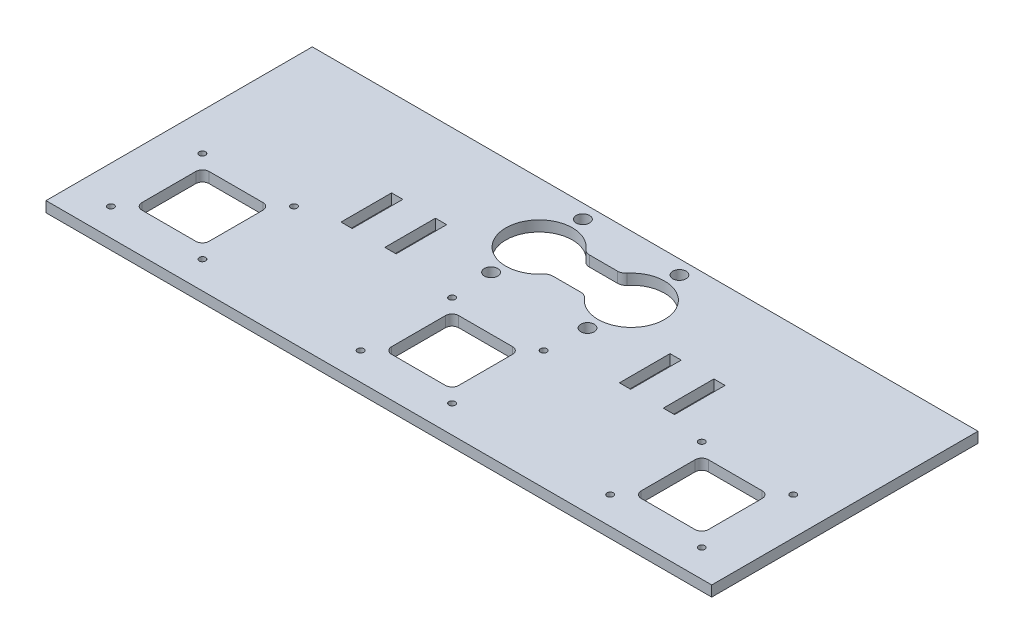
from build123d import *

# Parameters (mm, degrees)
SKETCH1_W           = 200
SKETCH1_H           = 80
BOSS_EXTRUDE1_DEPTH = 3.175
SKETCH3_W           = 20.17
SKETCH3_H           = 20.17
CUT_EXTRUDE2_DEPTH  = 108.750084107
SKETCH5_R           = 2
CUT_EXTRUDE3_DEPTH  = 108.750084107
SKETCH6_R           = 0.95
CUT_EXTRUDE4_DEPTH  = 108.750084107
CUT_EXTRUDE5_DEPTH  = 108.750084107
FILLET1_R           = 2


with BuildPart() as part:
    # Sketch1 → Boss-Extrude1 (new body)
    with BuildSketch(Plane(origin=(0, 0, 0), x_dir=(1, 0, 0), z_dir=(0, 1, 0))):
        Rectangle(SKETCH1_W, SKETCH1_H)
    extrude(amount=BOSS_EXTRUDE1_DEPTH)

    # Sketch3 → Cut-Extrude2 (cut, through all)
    with BuildSketch(Plane(origin=(0, 3.175, 0), x_dir=(1, 0, 0), z_dir=(0, 1, 0))):
        with Locations((75, -18)):
            Rectangle(SKETCH3_W, SKETCH3_H)
        with Locations((-75, -18)):
            Rectangle(SKETCH3_W, SKETCH3_H)
        with Locations((0, -18)):
            Rectangle(SKETCH3_W, SKETCH3_H)
        with BuildLine():
            Line((4.245313644, 27.5), (-4.245313644, 27.5))
            ThreePointArc((-4.245313644, 27.5), (-5.305973816, 27.736153715), (-6.166250915, 28.4))
            ThreePointArc((-6.166250915, 28.4), (-23.85, 22), (-6.166250915, 15.6))
            ThreePointArc((-6.166250915, 15.6), (-5.305973816, 16.263846285), (-4.245313644, 16.5))
            Line((-4.245313644, 16.5), (4.245313644, 16.5))
            ThreePointArc((4.245313644, 16.5), (5.305973816, 16.263846285), (6.166250915, 15.6))
            ThreePointArc((6.166250915, 15.6), (23.85, 22), (6.166250915, 28.4))
            ThreePointArc((6.166250915, 28.4), (5.305973816, 27.736153715), (4.245313644, 27.5))
        make_face()
    extrude(amount=-CUT_EXTRUDE2_DEPTH, mode=Mode.SUBTRACT)

    # Sketch5 → Cut-Extrude3 (cut, through all)
    with BuildSketch(Plane.XZ):
        with Locations(Location((14.5, -8.2, 0), (0, 0, 270))):
            Circle(SKETCH5_R)
        with Locations(Location((-14.5, -8.2, 0), (0, 0, 270))):
            Circle(SKETCH5_R)
        with Locations(Location((14.5, -35.8, 0), (0, 0, 270))):
            Circle(SKETCH5_R)
        with Locations(Location((-14.5, -35.8, 0), (0, 0, 270))):
            Circle(SKETCH5_R)
    extrude(amount=-CUT_EXTRUDE3_DEPTH, mode=Mode.SUBTRACT)

    # Sketch6 → Cut-Extrude4 (cut, through all)
    with BuildSketch(Plane.XZ):
        with Locations(Location((-61.25, 4.25, 0), (0, 0, 270))):
            Circle(SKETCH6_R)
        with Locations(Location((13.75, 4.25, 0), (0, 0, 270))):
            Circle(SKETCH6_R)
        with Locations(Location((-88.75, 4.25, 0), (0, 0, 270))):
            Circle(SKETCH6_R)
        with Locations(Location((-61.25, 31.75, 0), (0, 0, 270))):
            Circle(SKETCH6_R)
        with Locations(Location((-13.75, 4.25, 0), (0, 0, 270))):
            Circle(SKETCH6_R)
        with Locations(Location((-13.75, 31.75, 0), (0, 0, 270))):
            Circle(SKETCH6_R)
        with Locations(Location((13.75, 31.75, 0), (0, 0, 270))):
            Circle(SKETCH6_R)
        with Locations(Location((88.75, 31.75, 0), (0, 0, 270))):
            Circle(SKETCH6_R)
        with Locations(Location((61.25, 31.75, 0), (0, 0, 270))):
            Circle(SKETCH6_R)
        with Locations(Location((61.25, 4.25, 0), (0, 0, 270))):
            Circle(SKETCH6_R)
        with Locations(Location((88.75, 4.25, 0), (0, 0, 270))):
            Circle(SKETCH6_R)
        with Locations(Location((-88.75, 31.75, 0), (0, 0, 270))):
            Circle(SKETCH6_R)
    extrude(amount=-CUT_EXTRUDE4_DEPTH, mode=Mode.SUBTRACT)

    # Sketch7 → Cut-Extrude5 (cut, through all)
    with BuildSketch(Plane(origin=(0, 3.175, 0), x_dir=(1, 0, 0), z_dir=(0, 1, 0))):
        Polygon((-50.1, 13.925), (-50.1, 12.825), (-50.1, -0.175), (-50.1, -1.275), (-46.725, -1.275), (-46.725, -0.175), (-46.725, 12.825), (-46.725, 13.925), align=None)
        Polygon((-36.925, -0.175), (-36.925, -1.275), (-33.55, -1.275), (-33.55, -0.175), (-33.55, 12.825), (-33.55, 13.925), (-36.925, 13.925), (-36.925, 12.825), align=None)
        Polygon((33.55, 13.925), (33.55, 12.825), (33.55, -0.175), (33.55, -1.275), (36.925, -1.275), (36.925, -0.175), (36.925, 12.825), (36.925, 13.925), align=None)
        Polygon((46.725, -0.175), (46.725, -1.275), (50.1, -1.275), (50.1, -0.175), (50.1, 12.825), (50.1, 13.925), (46.725, 13.925), (46.725, 12.825), align=None)
    extrude(amount=-CUT_EXTRUDE5_DEPTH, mode=Mode.SUBTRACT)

    # Fillet1
    fillet1_edges = [part.edges().sort_by_distance(p)[0] for p in [
        (85.085, 1.5875, 7.915),
        (85.085, 1.5875, 28.085),
        (64.915, 1.5875, 28.085),
        (64.915, 1.5875, 7.915),
        (-64.915, 1.5875, 7.915),
        (-64.915, 1.5875, 28.085),
        (-85.085, 1.5875, 28.085),
        (-85.085, 1.5875, 7.915),
        (10.085, 1.5875, 7.915),
        (10.085, 1.5875, 28.085),
        (-10.085, 1.5875, 28.085),
        (-10.085, 1.5875, 7.915),
    ]]
    fillet(fillet1_edges, radius=FILLET1_R)


solid = part.part
